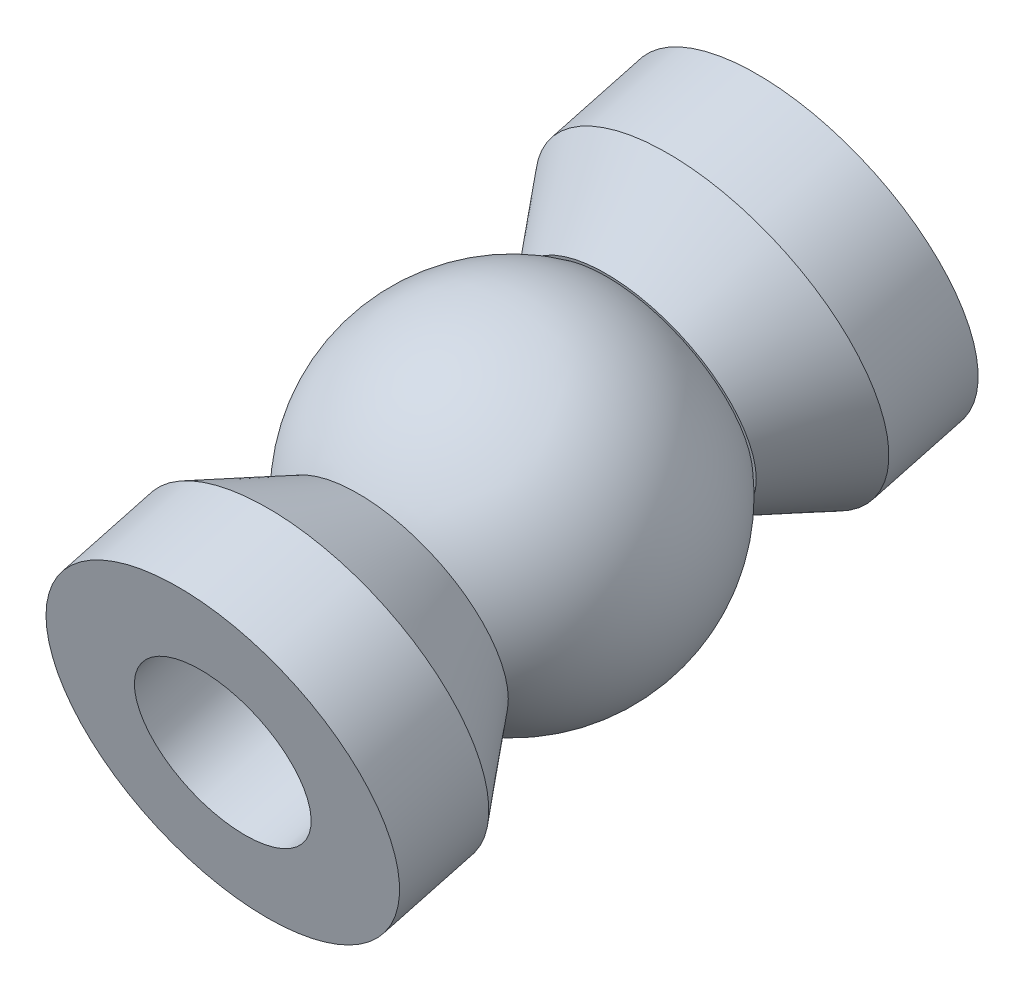
from build123d import *

# Parameters (mm, degrees)
F_1_4_CLEARANCE_HOLE1_D = 6.35


with BuildPart() as part:
    # Sketch1 → Revolve1 (revolve)
    with BuildSketch(Plane(origin=(0, 0, 0), x_dir=(0, 0, -1), z_dir=(1, 0, 0))):
        with BuildLine():
            Line((23.142718313, -40.383438187), (26.454877971, -39.495947681))
            Line((26.454877971, -39.495947681), (28.75042701, -36.777175972))
            Line((28.75042701, -36.777175972), (28.719920063, -36.663322494))
            ThreePointArc((28.719920063, -36.663322494), (33.876569057, -37.507311548), (37.920363558, -34.198071089))
            Line((37.920363558, -34.198071089), (37.950870506, -34.311924567))
            Line((37.950870506, -34.311924567), (41.298260144, -35.518675415))
            Line((41.298260144, -35.518675415), (44.610419802, -34.63118491))
            Line((44.610419802, -34.63118491), (42.966918866, -28.497555913))
            Line((42.966918866, -28.497555913), (36.833289869, -30.141056849))
            Line((36.833289869, -30.141056849), (37.655040337, -33.207871348))
            Line((37.655040337, -33.207871348), (28.454596842, -35.673122752))
            Line((28.454596842, -35.673122752), (27.632846373, -32.606308254))
            Line((27.632846373, -32.606308254), (21.499217376, -34.24980919))
            Line((21.499217376, -34.24980919), (23.142718313, -40.383438187))
        make_face()
    revolve(axis=Axis((0, -34.24980919, -21.499217376), (0, 0.258819045102523, -0.9659258262890678)))

    # 1/4 Clearance Hole1 (through all)
    with Locations(Plane(origin=(0, 3.080502166, -11.496590595), x_dir=(1, 0, 0), z_dir=(0, -0.25881904510252046, 0.9659258262890684))):
        with Locations((0, -38.647182154)):
            Hole(F_1_4_CLEARANCE_HOLE1_D / 2)


solid = part.part
